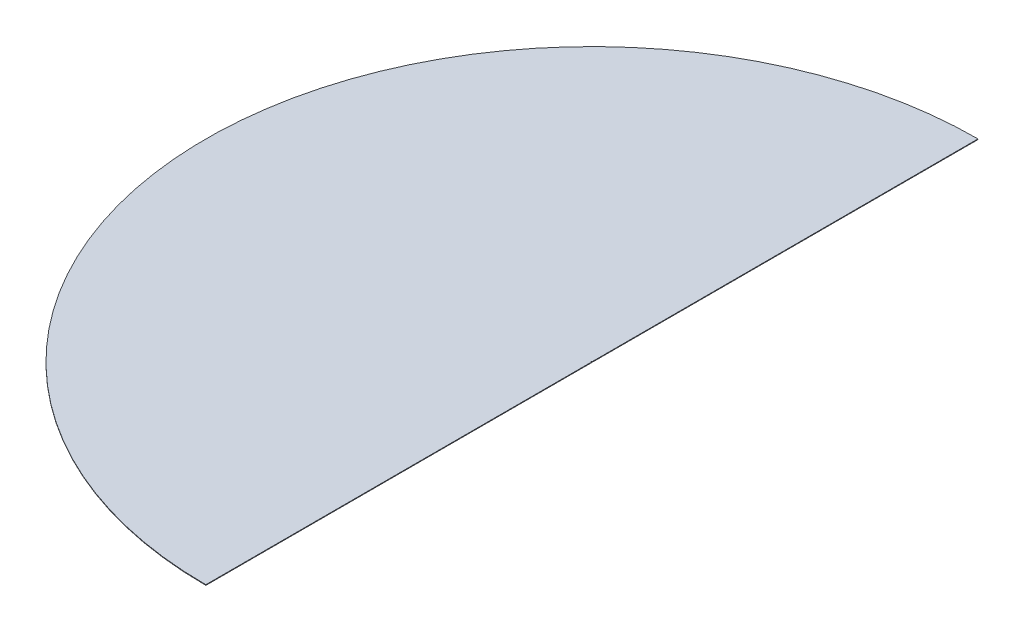
from build123d import *

# Parameters (mm, degrees)
BOSS_EXTRUDE1_DEPTH = 31.5


with BuildPart() as part:
    # Sketch1 → Boss-Extrude1 (new body)
    with BuildSketch(Plane(origin=(0, 0, 0), x_dir=(1, 0, 0), z_dir=(0, 1, 0))):
        with BuildLine():
            Line((0, 20000), (0, 28.5))
            ThreePointArc((0, 28.5), (-28.5, 0), (0, -28.5))
            Line((0, -28.5), (0, -20000))
            ThreePointArc((0, -20000), (-20000, 0), (0, 20000))
        make_face()
    extrude(amount=BOSS_EXTRUDE1_DEPTH)


solid = part.part
